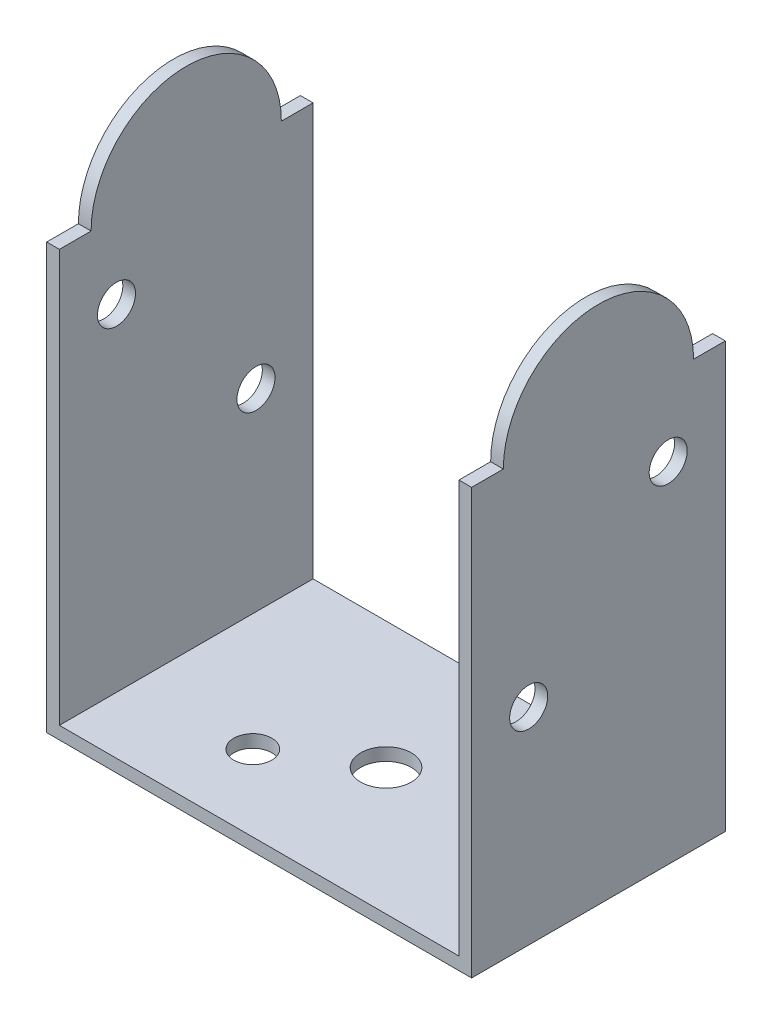
from build123d import *

# Parameters (mm, degrees)
BOSS_EXTRUDE1_DEPTH      = 40
SKETCH2_R                = 4
SKETCH2_R_2              = 3
CUT_EXTRUDE2_DEPTH       = 2
CUT_EXTRUDE8_DEPTH       = 114.194522836
CUT_EXTRUDE8_DEPTH_BACK  = 2
SKETCH5_R                = 3
CUT_EXTRUDE9_DEPTH       = 2
SKETCH6_R                = 3
CUT_EXTRUDE10_DEPTH      = 2
CUT_EXTRUDE11_DEPTH      = 114.194522836
CUT_EXTRUDE11_DEPTH_BACK = 2


with BuildPart() as part:
    # MetalPart → Boss-Extrude1 (new body)
    with BuildSketch(Plane.XY):
        Polygon((0, 0), (-33.5, 0), (-33.5, 82), (-31.5, 82), (-31.5, 2), (31.5, 2), (31.5, 82), (33.5, 82), (33.5, 0), align=None)
    extrude(amount=BOSS_EXTRUDE1_DEPTH)

    # Sketch2 → Cut-Extrude2 (cut)
    with BuildSketch(Plane.XZ):
        with Locations((0, 20)):
            Circle(SKETCH2_R)
        with Locations((-13, 28)):
            Circle(SKETCH2_R_2)
        with Locations((13, 12)):
            Circle(SKETCH2_R_2)
    extrude(amount=-CUT_EXTRUDE2_DEPTH, mode=Mode.SUBTRACT)

    # Sketch3 → Cut-Extrude8 (cut, two sides: drawn at the far end of the back side and taken through both)
    with BuildSketch(Plane(origin=(33.5, 0, 0), x_dir=(0, 0, -1), z_dir=(1, 0, 0)).offset(-CUT_EXTRUDE8_DEPTH_BACK)):
        with BuildLine():
            Line((-206.064089399, 67), (-40, 67))
            Line((-40, 67), (-35, 67))
            ThreePointArc((-35, 67), (-20, 82), (-5, 67))
            Line((-5, 67), (0, 67))
            Line((0, 67), (166.064089399, 67))
            Line((166.064089399, 67), (166.064089399, 399.128178798))
            Line((166.064089399, 399.128178798), (-206.064089399, 399.128178798))
            Line((-206.064089399, 399.128178798), (-206.064089399, 67))
        make_face()
    extrude(amount=CUT_EXTRUDE8_DEPTH + CUT_EXTRUDE8_DEPTH_BACK, mode=Mode.SUBTRACT)

    # Sketch5 → Cut-Extrude9 (cut)
    with BuildSketch(Plane(origin=(33.5, 0, 0), x_dir=(0, 0, -1), z_dir=(1, 0, 0))):
        with Locations((-9, 55)):
            Circle(SKETCH5_R)
        with Locations((-31, 32.5)):
            Circle(SKETCH5_R)
    extrude(amount=-CUT_EXTRUDE9_DEPTH, mode=Mode.SUBTRACT)

    # Sketch6 → Cut-Extrude10 (cut)
    with BuildSketch(Plane.ZY.offset(33.5)):
        with Locations((9, 32.5)):
            Circle(SKETCH6_R)
        with Locations((31, 55)):
            Circle(SKETCH6_R)
    extrude(amount=-CUT_EXTRUDE10_DEPTH, mode=Mode.SUBTRACT)

    # Sketch7 → Cut-Extrude11 (cut, two sides: drawn at the far end of the back side and taken through both)
    with BuildSketch(Plane.ZY.offset(33.5).offset(-CUT_EXTRUDE11_DEPTH_BACK)):
        with BuildLine():
            Line((-166.064089399, 67), (0, 67))
            Line((0, 67), (5, 67))
            ThreePointArc((5, 67), (20, 82), (35, 67))
            Line((35, 67), (40, 67))
            Line((40, 67), (206.064089399, 67))
            Line((206.064089399, 67), (206.064089399, 399.128178798))
            Line((206.064089399, 399.128178798), (-166.064089399, 399.128178798))
            Line((-166.064089399, 399.128178798), (-166.064089399, 67))
        make_face()
    extrude(amount=CUT_EXTRUDE11_DEPTH + CUT_EXTRUDE11_DEPTH_BACK, mode=Mode.SUBTRACT)


solid = part.part
